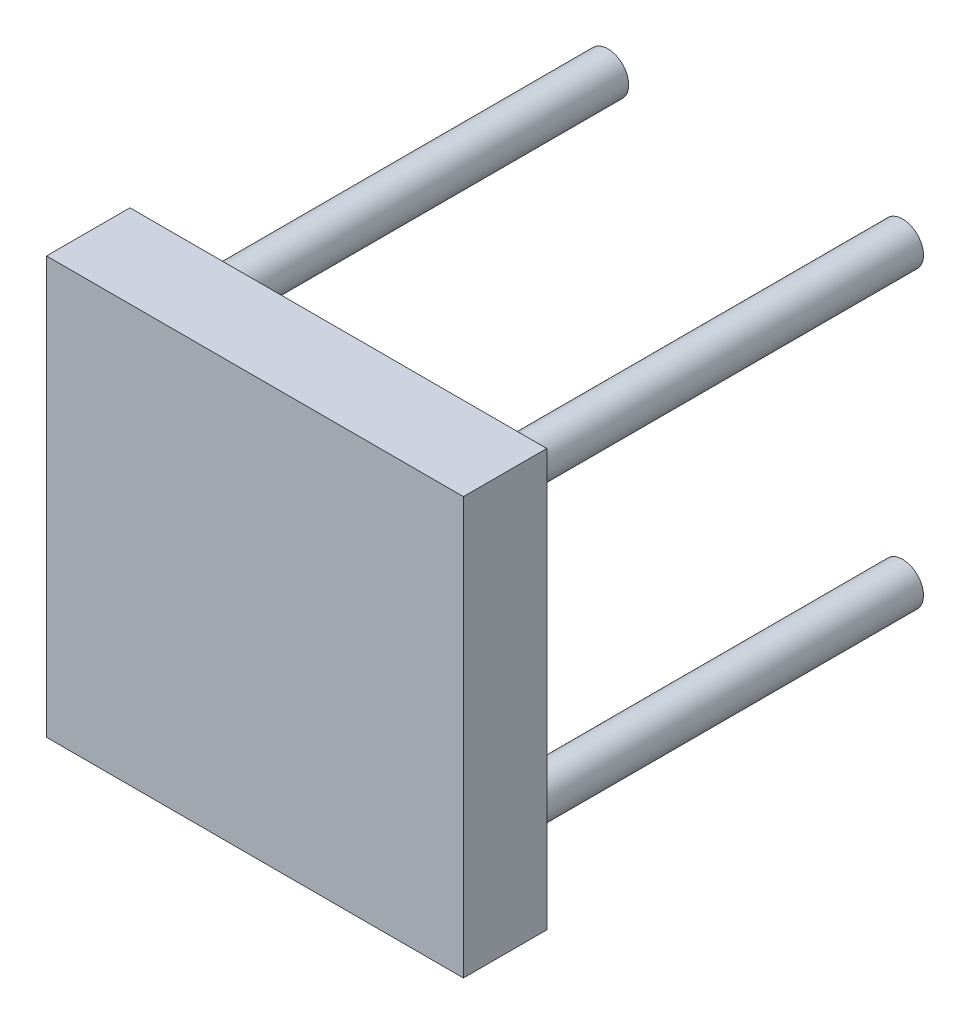
from build123d import *

# Parameters (mm, degrees)
SKETCH1_W               = 0.1
SKETCH1_H               = 0.1
BOSS_EXTRUDE1_DEPTH     = 0.02
SKETCH3_R               = 0.005
BOSS_EXTRUDE2_DEPTH     = 0.1
MIRROR2_COPY_1_SKETCH_R = 0.005
MIRROR2_COPY_1_DEPTH    = 0.1


with BuildPart() as part:
    # Sketch1 → Boss-Extrude1 (new body)
    with BuildSketch(Plane.XY):
        Rectangle(SKETCH1_W, SKETCH1_H)
    extrude(amount=-BOSS_EXTRUDE1_DEPTH)

    # Sketch3 → Boss-Extrude2 (add)
    with BuildSketch(Plane(origin=(0, 0, -0.02), x_dir=(-1, 0, 0), z_dir=(0, 0, -1))):
        with Locations((-0.035355339, 0.035355339)):
            Circle(SKETCH3_R)
    boss_extrude2 = extrude(amount=BOSS_EXTRUDE2_DEPTH)

    # Mirror1: Boss-Extrude2 across plane
    add(boss_extrude2.mirror(Plane(origin=(0, 0, 0), x_dir=(0, 0, 1), z_dir=(1, 0, 0))))

    # Mirror2: Boss-Extrude2 across plane
    add(boss_extrude2.mirror(Plane.ZX))

    # Mirror2 copy 1 sketch → Mirror2 copy 1 (add)
    with BuildSketch(Plane(origin=(0, 0, -0.02), x_dir=(1, 0, 0), z_dir=(0, 0, -1))):
        with Locations((-0.035355339, 0.035355339)):
            Circle(MIRROR2_COPY_1_SKETCH_R)
    extrude(amount=MIRROR2_COPY_1_DEPTH)


solid = part.part
